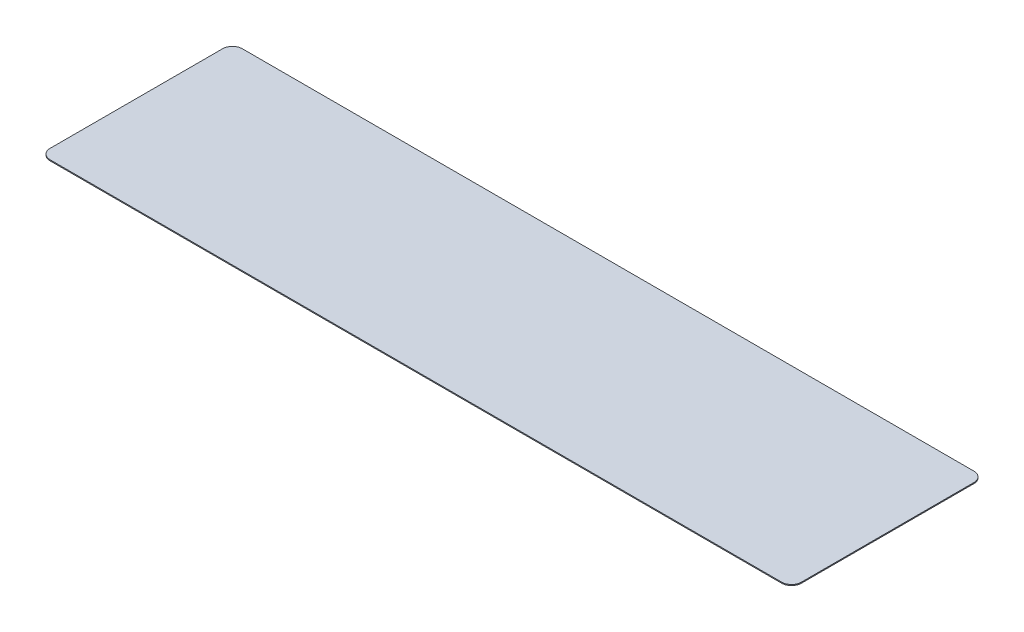
from build123d import *

# Parameters (mm, degrees)
EXTRUDE_1_DEPTH = 0.2


with BuildPart() as part:
    # Эскиз2 → Бобышка-Вытянуть1 (new body)
    with BuildSketch(Plane(origin=(0, 0, 0), x_dir=(1, 0, 0), z_dir=(0, 1, 0))):
        with BuildLine():
            Line((74.2, -19.5), (-74.2, -19.5))
            ThreePointArc((-74.2, -19.5), (-75.614213562, -18.914213562), (-76.2, -17.5))
            Line((-76.2, -17.5), (-76.2, 17.5))
            ThreePointArc((-76.2, 17.5), (-75.614213562, 18.914213562), (-74.2, 19.5))
            Line((-74.2, 19.5), (74.2, 19.5))
            ThreePointArc((74.2, 19.5), (75.614213562, 18.914213562), (76.2, 17.5))
            Line((76.2, 17.5), (76.2, -17.5))
            ThreePointArc((76.2, -17.5), (75.614213562, -18.914213562), (74.2, -19.5))
        make_face()
    extrude(amount=EXTRUDE_1_DEPTH)


solid = part.part
